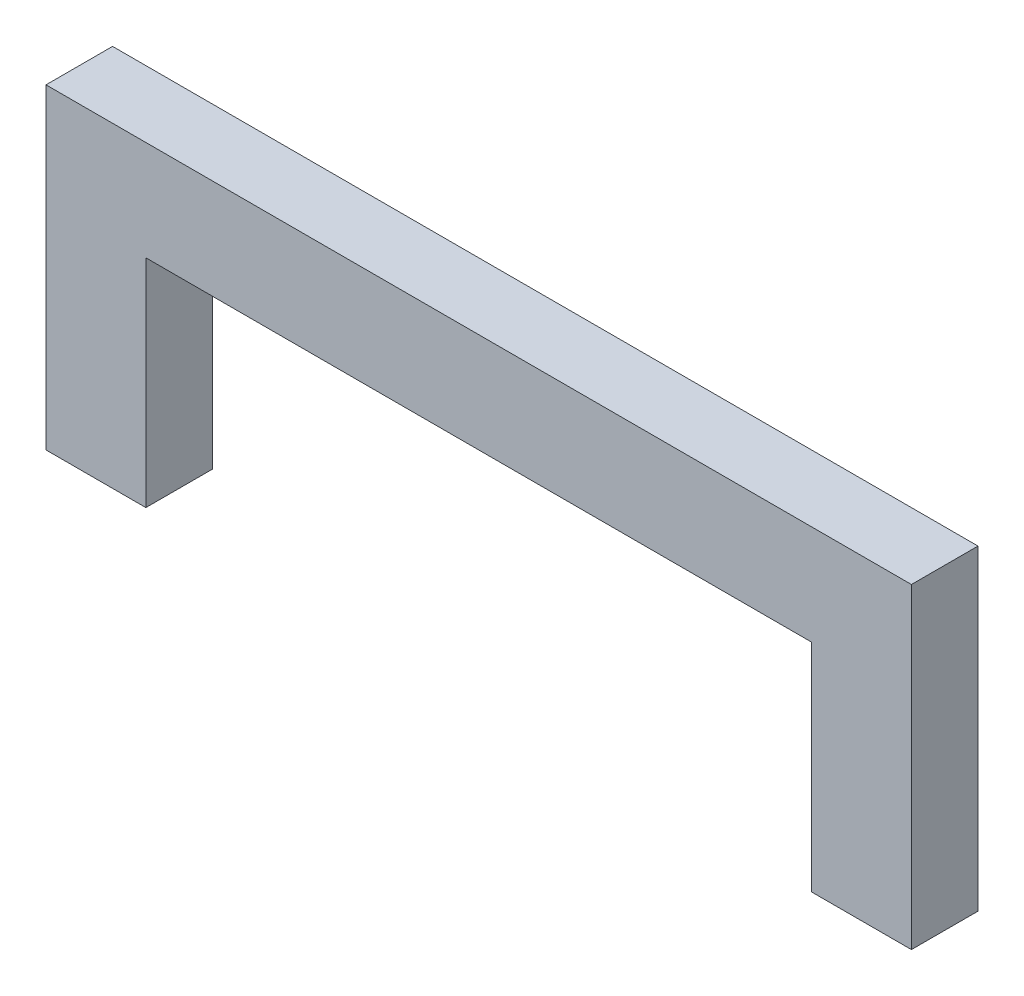
from build123d import *

# Parameters (mm, degrees)
BOSS_EXTRUDE1_DEPTH = 6.35


with BuildPart() as part:
    # Sketch1 → Boss-Extrude1 (new, symmetric)
    with BuildSketch(Plane.XY):
        Polygon((-63.5, 0), (-82.55, 0), (-82.55, 60.325), (82.55, 60.325), (82.55, 0), (63.5, 0), (63.5, 41.275), (-63.5, 41.275), align=None)
    extrude(amount=BOSS_EXTRUDE1_DEPTH, both=True)


solid = part.part
